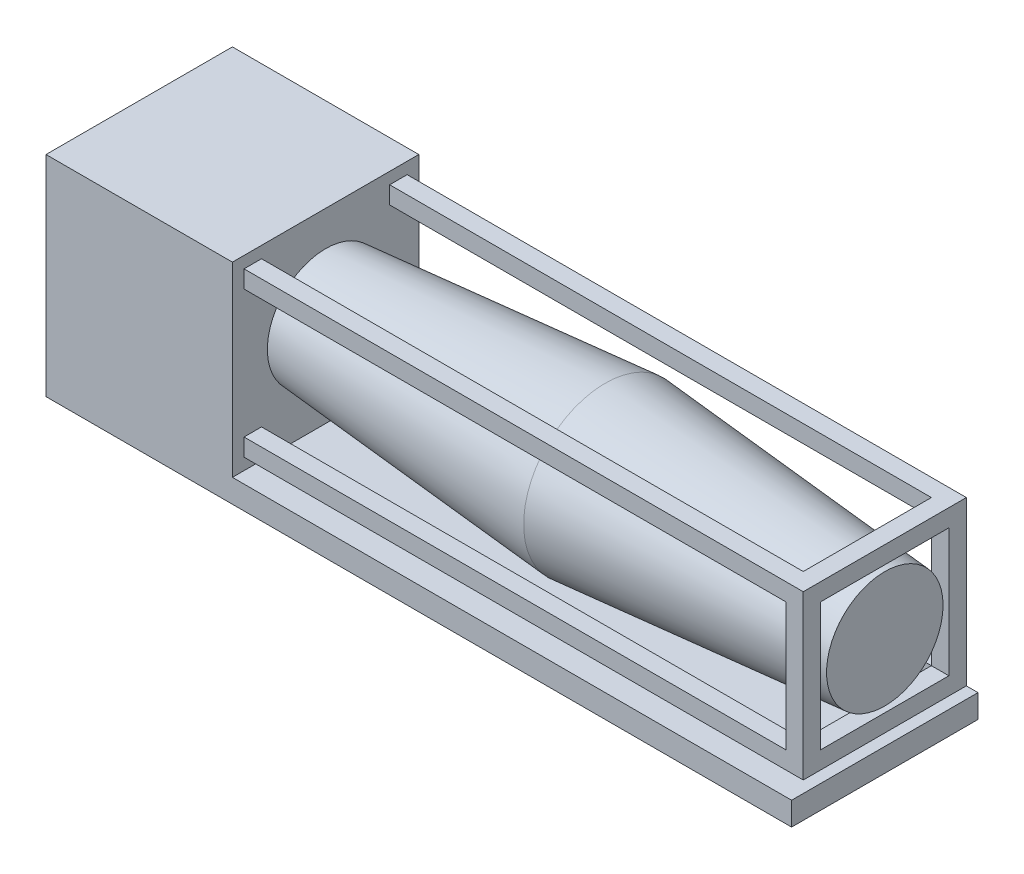
from build123d import *

# Parameters (mm, degrees)
SKETCH1_W           = 640
SKETCH1_H           = 160
BOSS_EXTRUDE1_DEPTH = 180
SKETCH2_W           = 160
SKETCH2_H           = 160
CUT_EXTRUDE1_DEPTH  = 480
SKETCH3_R           = 70
BOSS_EXTRUDE2_DEPTH = 480
SKETCH4_W           = 15
SKETCH4_H           = 15
BOSS_EXTRUDE3_DEPTH = 480
SKETCH7_W           = 15
SKETCH7_H           = 15
BOSS_EXTRUDE4_DEPTH = 110
SKETCH8_W           = 15
SKETCH8_H           = 15
BOSS_EXTRUDE5_DEPTH = 110


with BuildPart() as part:
    # Sketch1 → Boss-Extrude1 (new body)
    with BuildSketch(Plane(origin=(0, 0, 0), x_dir=(1, 0, 0), z_dir=(0, 1, 0))):
        with Locations((320, 80)):
            Rectangle(SKETCH1_W, SKETCH1_H)
    extrude(amount=BOSS_EXTRUDE1_DEPTH)

    # Sketch2 → Cut-Extrude1 (cut)
    with BuildSketch(Plane(origin=(640, 0, 0), x_dir=(0, 0, -1), z_dir=(1, 0, 0))):
        with Locations((80, 100)):
            Rectangle(SKETCH2_W, SKETCH2_H)
    extrude(amount=-CUT_EXTRUDE1_DEPTH, mode=Mode.SUBTRACT)

    # Sketch3 → Boss-Extrude2 (add)
    with BuildSketch(Plane(origin=(160, 0, 0), x_dir=(0, 0, -1), z_dir=(1, 0, 0))):
        with Locations(Location((80, 100, 0), (0, 0, 180))):
            Circle(SKETCH3_R)
    extrude(amount=BOSS_EXTRUDE2_DEPTH)

    # Sketch6 → Cut-Revolve1 (revolve, cut)
    with BuildSketch(Plane.XY.offset(-80), mode=Mode.PRIVATE) as cut_revolve1_sk:
        Polygon((160, 170), (160, 150), (400, 170), align=None)
        Polygon((640, 150), (400, 170), (640, 170), align=None)
    revolve(cut_revolve1_sk.sketch.rotate(Axis((640, 100, -80), (-1, 0, 0)), 90), axis=Axis((640, 100, -80), (-1, 0, 0)), mode=Mode.SUBTRACT)

    # Sketch4 → Boss-Extrude3 (add)
    with BuildSketch(Plane(origin=(160, 0, 0), x_dir=(0, 0, -1), z_dir=(1, 0, 0))):
        with Locations((17.5, 162.5)):
            Rectangle(SKETCH4_W, SKETCH4_H)
        with Locations((142.5, 162.5)):
            Rectangle(SKETCH4_W, SKETCH4_H)
        with Locations((142.5, 37.5)):
            Rectangle(SKETCH4_W, SKETCH4_H)
        with Locations((17.5, 37.5)):
            Rectangle(SKETCH4_W, SKETCH4_H)
    extrude(amount=BOSS_EXTRUDE3_DEPTH)

    # Sketch7 → Boss-Extrude4 (add)
    with BuildSketch(Plane(origin=(0, 0, -25), x_dir=(-1, 0, 0), z_dir=(0, 0, -1))):
        with Locations((-632.5, 162.5)):
            Rectangle(SKETCH7_W, SKETCH7_H)
    boss_extrude4 = extrude(amount=BOSS_EXTRUDE4_DEPTH)

    # Mirror1: Boss-Extrude4 across plane
    add(boss_extrude4.mirror(Plane.ZX.offset(100)))

    # Sketch8 → Boss-Extrude5 (add)
    with BuildSketch(Plane(origin=(0, 45, 0), x_dir=(1, 0, 0), z_dir=(0, 1, 0))):
        with Locations((632.5, 17.5)):
            Rectangle(SKETCH8_W, SKETCH8_H)
        with Locations((632.5, 142.5)):
            Rectangle(SKETCH8_W, SKETCH8_H)
    extrude(amount=BOSS_EXTRUDE5_DEPTH)


solid = part.part
